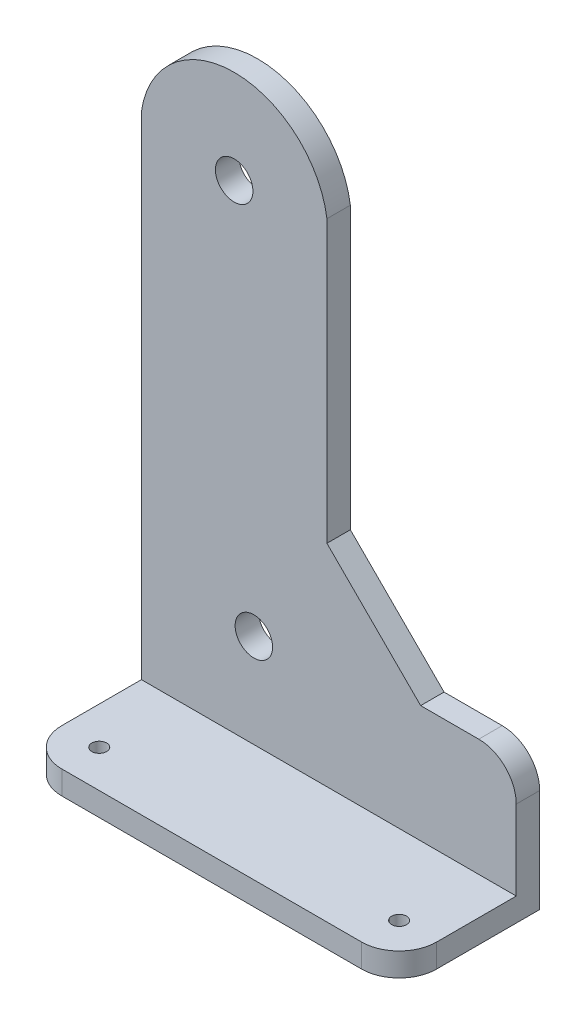
from build123d import *

# Parameters (mm, degrees)
BOSS_EXTRUDE1_DEPTH = 25
SKETCH2_W           = 400
SKETCH2_H           = 25
BOSS_EXTRUDE2_DEPTH = 150
CUT_EXTRUDE1_DEPTH  = 150
SKETCH4_R           = 7.94
CUT_EXTRUDE2_DEPTH  = 150
SKETCH5_R           = 20
CUT_EXTRUDE3_DEPTH  = 150


with BuildPart() as part:
    # Sketch1 → Boss-Extrude1 (new body)
    with BuildSketch(Plane.XY):
        with BuildLine():
            Line((-61.550518812, -258.970259643), (338.449481188, -258.970259643))
            Line((338.449481188, -258.970259643), (338.449481188, -148.970259643))
            ThreePointArc((338.449481188, -148.970259643), (326.733752435, -120.685988396), (298.449481188, -108.970259643))
            Line((298.449481188, -108.970259643), (236.429070899, -108.970259643))
            Line((236.429070899, -108.970259643), (136.429070899, -8.970259643))
            Line((136.429070899, -8.970259643), (136.429070899, 291.029740357))
            ThreePointArc((136.429070899, 291.029740357), (37.439276043, 376.851570008), (-61.550518812, 291.029740357))
            Line((-61.550518812, 291.029740357), (-61.550518812, -258.970259643))
        make_face()
    extrude(amount=BOSS_EXTRUDE1_DEPTH)

    # Sketch2 → Boss-Extrude2 (add)
    with BuildSketch(Plane.XY):
        with Locations((138.449481188, -246.470259643)):
            Rectangle(SKETCH2_W, SKETCH2_H)
    extrude(amount=BOSS_EXTRUDE2_DEPTH)

    # Sketch3 → Cut-Extrude1 (cut)
    with BuildSketch(Plane(origin=(0, -233.970259643, 0), x_dir=(1, 0, 0), z_dir=(0, 1, 0))):
        with BuildLine():
            Line((338.449481188, -110), (338.449481188, -150))
            Line((338.449481188, -150), (298.449481188, -150))
            ThreePointArc((298.449481188, -150), (326.733752435, -138.284271247), (338.449481188, -110))
        make_face()
        with BuildLine():
            Line((-61.550518812, -110), (-61.550518812, -150))
            Line((-61.550518812, -150), (-21.550518812, -150))
            ThreePointArc((-21.550518812, -150), (-49.83479006, -138.284271247), (-61.550518812, -110))
        make_face()
    extrude(amount=-CUT_EXTRUDE1_DEPTH, mode=Mode.SUBTRACT)

    # Sketch4 → Cut-Extrude2 (cut)
    with BuildSketch(Plane(origin=(0, -233.970259643, 0), x_dir=(1, 0, 0), z_dir=(0, 1, 0))):
        with Locations(Location((-21.550518812, -110, 0), (0, 0, 270))):
            Circle(SKETCH4_R)
        with Locations(Location((298.449481188, -110, 0), (0, 0, 270))):
            Circle(SKETCH4_R)
    extrude(amount=-CUT_EXTRUDE2_DEPTH, mode=Mode.SUBTRACT)

    # Sketch5 → Cut-Extrude3 (cut)
    with BuildSketch(Plane.XY.offset(25)):
        with Locations((37.439276043, 276.851570008)):
            Circle(SKETCH5_R)
        with Locations((58.449481188, -133.970259643)):
            Circle(SKETCH5_R)
    extrude(amount=-CUT_EXTRUDE3_DEPTH, mode=Mode.SUBTRACT)


solid = part.part
